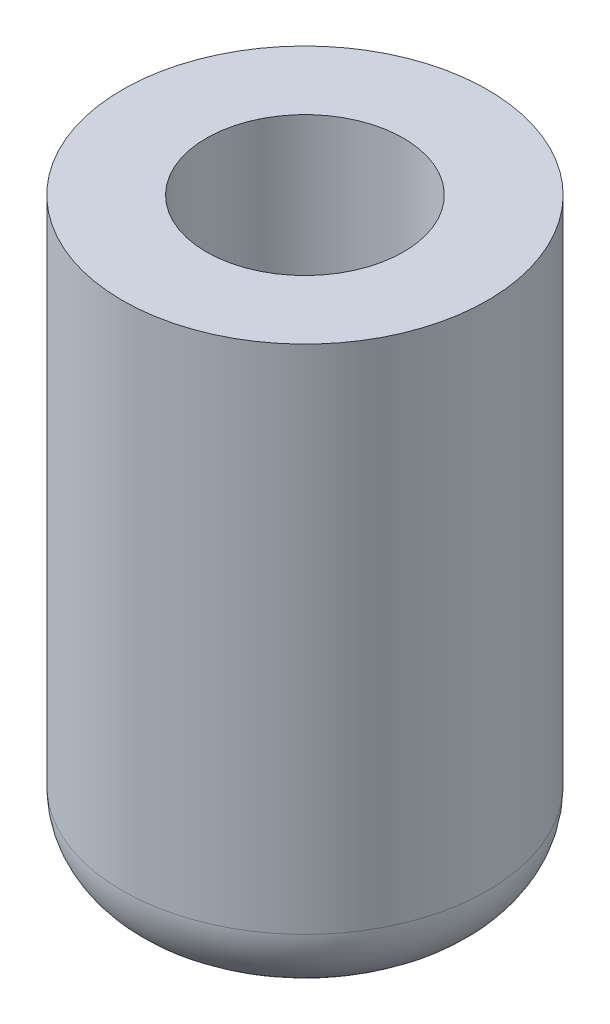
from build123d import *

# Parameters (mm, degrees)
SKETCH1_R           = 6.35
BOSS_EXTRUDE1_DEPTH = 20.32
SKETCH2_R           = 3.429
CUT_EXTRUDE1_DEPTH  = 17.78
FILLET1_R           = 2.54


with BuildPart() as part:
    # Sketch1 → Boss-Extrude1 (new body)
    with BuildSketch(Plane(origin=(0, 0, 0), x_dir=(1, 0, 0), z_dir=(0, 1, 0))):
        with Locations(Location((0, 0, 0), (0, 0, 270))):
            Circle(SKETCH1_R)
    extrude(amount=BOSS_EXTRUDE1_DEPTH)

    # Sketch2 → Cut-Extrude1 (cut)
    with BuildSketch(Plane(origin=(0, 20.32, 0), x_dir=(1, 0, 0), z_dir=(0, 1, 0))):
        with Locations(Location((0, 0, 0), (0, 0, 270))):
            Circle(SKETCH2_R)
    extrude(amount=-CUT_EXTRUDE1_DEPTH, mode=Mode.SUBTRACT)

    # Fillet1
    fillet1_edges = [part.edges().sort_by_distance(p)[0] for p in [
        (0, 0, -6.35),
    ]]
    fillet(fillet1_edges, radius=FILLET1_R)


solid = part.part
